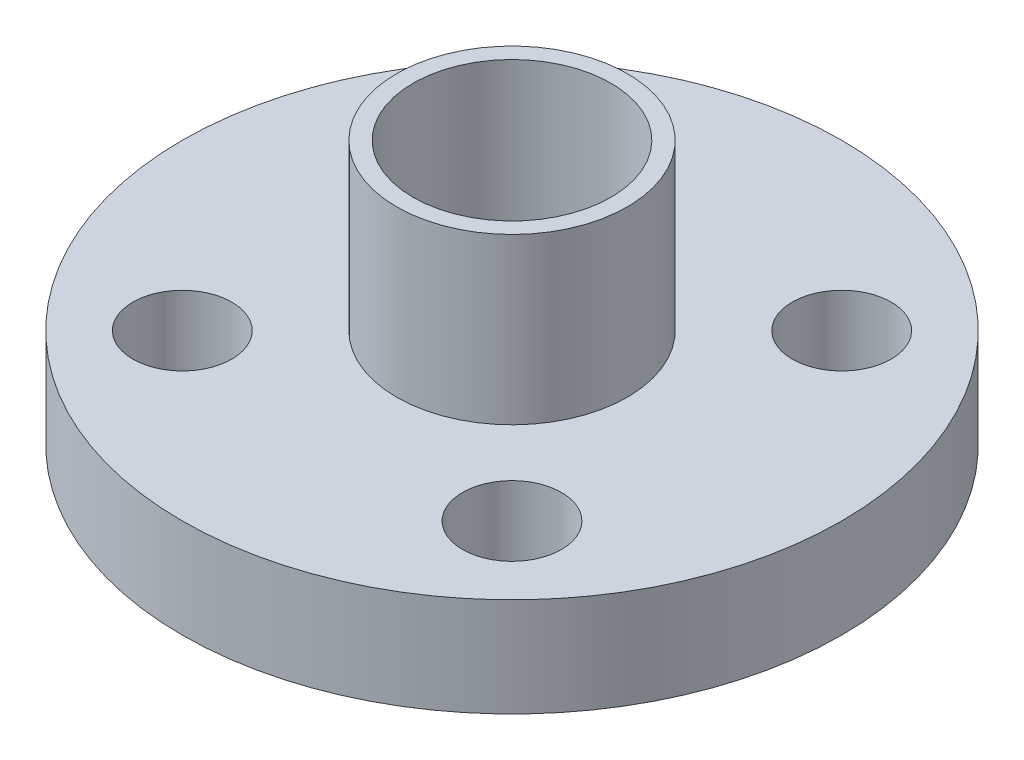
from build123d import *

# Parameters (mm, degrees)
SKETCH_1_R          = 10
SKETCH_1_R_2        = 1.5
EXTRUDE_1_DEPTH     = 3
SKETCH_2_R          = 3.5
SKETCH_2_R_2        = 3
EXTRUDE_2_DEPTH     = 5
SKETCH_3_R          = 1.5
CUT_EXTRUDE_1_DEPTH = 5


with BuildPart() as part:
    # 草图1 → 凸台-拉伸1 (new body)
    with BuildSketch(Plane(origin=(0, 0, 0), x_dir=(1, 0, 0), z_dir=(0, 1, 0))):
        with Locations(Location((0, 0, 0), (0, 0, 270))):
            Circle(SKETCH_1_R)
        with Locations(Location((-5, 5, 0), (0, 0, 270))):
            Circle(SKETCH_1_R_2, mode=Mode.SUBTRACT)
        with Locations(Location((5, 5, 0), (0, 0, 270))):
            Circle(SKETCH_1_R_2, mode=Mode.SUBTRACT)
        with Locations(Location((5, -5, 0), (0, 0, 270))):
            Circle(SKETCH_1_R_2, mode=Mode.SUBTRACT)
        with Locations(Location((-5, -5, 0), (0, 0, 270))):
            Circle(SKETCH_1_R_2, mode=Mode.SUBTRACT)
    extrude(amount=EXTRUDE_1_DEPTH)

    # 草图2 → 凸台-拉伸2 (add)
    with BuildSketch(Plane(origin=(0, 3, 0), x_dir=(1, 0, 0), z_dir=(0, 1, 0))):
        with Locations(Location((0, 0, 0), (0, 0, 270))):
            Circle(SKETCH_2_R)
        with Locations(Location((0, 0, 0), (0, 0, 270))):
            Circle(SKETCH_2_R_2, mode=Mode.SUBTRACT)
    extrude(amount=EXTRUDE_2_DEPTH)

    # 草图3 → 切除-拉伸1 (cut)
    with BuildSketch(Plane(origin=(0, 3, 0), x_dir=(1, 0, 0), z_dir=(0, 1, 0))):
        with Locations(Location((0, 0, 0), (0, 0, 270))):
            Circle(SKETCH_3_R)
    extrude(amount=-CUT_EXTRUDE_1_DEPTH, mode=Mode.SUBTRACT)


solid = part.part
